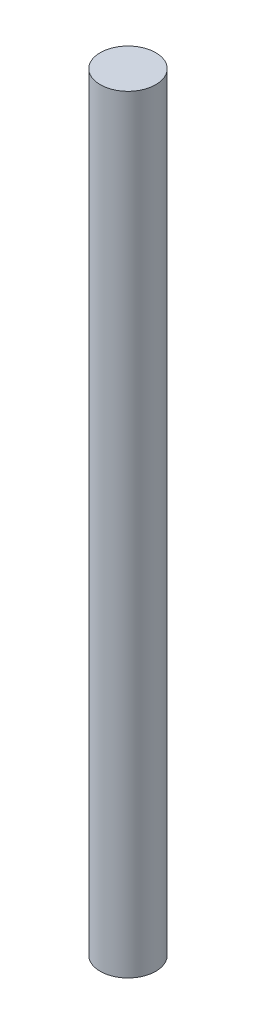
from build123d import *

# Parameters (mm, degrees)
SKETCH_1_R      = 1.5
EXTRUDE_1_DEPTH = 41.5


with BuildPart() as part:
    # 草图1 → 凸台-拉伸1 (new body)
    with BuildSketch(Plane(origin=(0, 0, 0), x_dir=(1, 0, 0), z_dir=(0, 1, 0))):
        with Locations(Location((0, 0, 0), (0, 0, 270))):
            Circle(SKETCH_1_R)
    extrude(amount=EXTRUDE_1_DEPTH)


solid = part.part
